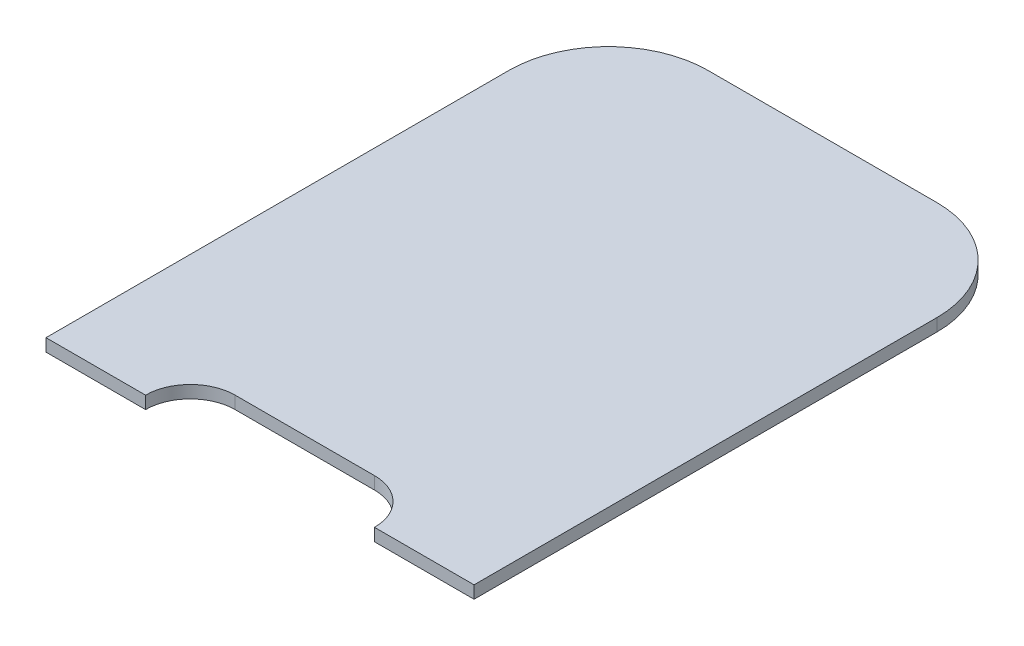
from build123d import *

# Parameters (mm, degrees)
BOSS_EXTRUDE1_DEPTH = 1.6


with BuildPart() as part:
    # Sketch2 → Boss-Extrude1 (new body)
    with BuildSketch(Plane(origin=(0, 0, 0), x_dir=(1, 0, 0), z_dir=(0, 1, 0))):
        with BuildLine():
            Line((0, 0), (12.7, 0))
            ThreePointArc((12.7, 0), (14.373884746, 4.041115254), (18.415, 5.715))
            Line((18.415, 5.715), (36.195, 5.715))
            ThreePointArc((36.195, 5.715), (40.236115254, 4.041115254), (41.91, 0))
            Line((41.91, 0), (54.61, 0))
            Line((54.61, 0), (54.61, 59.055))
            ThreePointArc((54.61, 59.055), (50.890256121, 68.035256121), (41.91, 71.755))
            Line((41.91, 71.755), (12.7, 71.755))
            ThreePointArc((12.7, 71.755), (3.719743879, 68.035256121), (0, 59.055))
            Line((0, 59.055), (0, 0))
        make_face()
    extrude(amount=BOSS_EXTRUDE1_DEPTH)


solid = part.part
